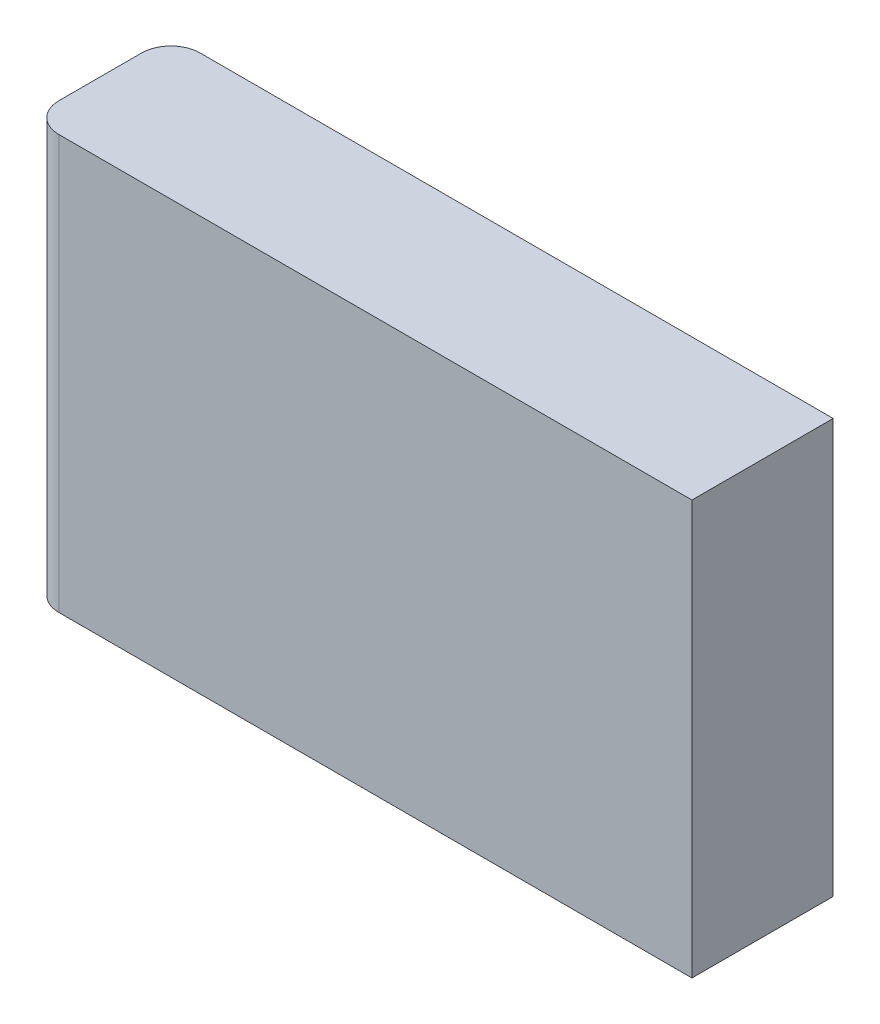
from build123d import *

# Parameters (mm, degrees)
SKETCH1_W           = 136
SKETCH1_H           = 85
BOSS_EXTRUDE1_DEPTH = 29
FILLET1_R           = 6


with BuildPart() as part:
    # Sketch1 → Boss-Extrude1 (new body)
    with BuildSketch(Plane.XY):
        Rectangle(SKETCH1_W, SKETCH1_H)
    extrude(amount=BOSS_EXTRUDE1_DEPTH)

    # Fillet1
    fillet1_edges = [part.edges().sort_by_distance(p)[0] for p in [
        (-68, 0, 29),
        (-68, 0, 0),
    ]]
    fillet(fillet1_edges, radius=FILLET1_R)


solid = part.part
